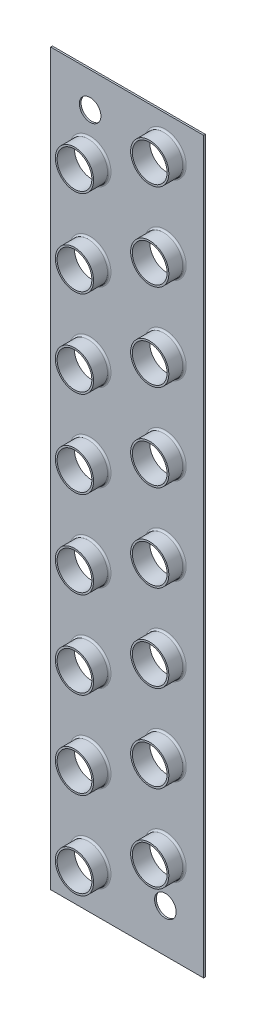
from build123d import *

# Parameters (mm, degrees)
SKETCH2_W           = 44
SKETCH2_H           = 210
BOSS_EXTRUDE1_DEPTH = 0.5
SKETCH3_R           = 5
CUT_EXTRUDE1_DEPTH  = 215.560597501
BOSS_EXTRUDE2_START = 4.5
SKETCH4_R           = 5.5
SKETCH4_R_2         = 5
BOSS_EXTRUDE2_DEPTH = 4.5
LPATTERN1_COUNT     = 8
LPATTERN1_PITCH     = 25
FILLET1_R           = 0.5
SKETCH5_R           = 3.1
CUT_EXTRUDE2_DEPTH  = 215.618265765


with BuildPart() as part:
    # Sketch2 → Boss-Extrude1 (new body)
    with BuildSketch(Plane.XY):
        with Locations((22, -105)):
            Rectangle(SKETCH2_W, SKETCH2_H)
    extrude(amount=BOSS_EXTRUDE1_DEPTH)

    # Sketch3 → Cut-Extrude1 (cut, through all)
    with BuildSketch(Plane.XY.offset(0.5)):
        with Locations((33, -10)):
            Circle(SKETCH3_R)
        with Locations((11.349364905, -22.5)):
            Circle(SKETCH3_R)
    cut_extrude1 = extrude(amount=-CUT_EXTRUDE1_DEPTH, mode=Mode.SUBTRACT)

    # Sketch4 → Boss-Extrude2 (add)
    # profile 1 of 2: a face of its own
    with BuildSketch(Plane.XY.offset(0.5).offset(BOSS_EXTRUDE2_START)):
        with Locations((11.349364905, -22.5)):
            Circle(SKETCH4_R)
        with Locations((11.349364905, -22.5)):
            Circle(SKETCH4_R_2, mode=Mode.SUBTRACT)
    # profile 2 of 2: a face of its own
    with BuildSketch(Plane.XY.offset(0.5).offset(BOSS_EXTRUDE2_START)):
        with Locations((33, -10)):
            Circle(SKETCH4_R)
        with Locations((33, -10)):
            Circle(SKETCH4_R_2, mode=Mode.SUBTRACT)
    boss_extrude2 = extrude(amount=-BOSS_EXTRUDE2_DEPTH)

    # LPattern1: Cut-Extrude1, Boss-Extrude2 ×8
    with Locations(*[(0, -i * LPATTERN1_PITCH, 0) for i in range(1, LPATTERN1_COUNT)]):
        add(cut_extrude1, mode=Mode.SUBTRACT)
        add(boss_extrude2)

    # Fillet1
    fillet1_edges = [part.edges().sort_by_distance(p)[0] for p in [
        (5.849364905, -72.5, 0.5),
        (27.5, -60, 0.5),
        (5.849364905, -97.5, 0.5),
        (27.5, -85, 0.5),
        (5.849364905, -122.5, 0.5),
        (27.5, -110, 0.5),
        (5.849364905, -147.5, 0.5),
        (27.5, -135, 0.5),
        (5.849364905, -172.5, 0.5),
        (27.5, -160, 0.5),
        (5.849364905, -197.5, 0.5),
        (27.5, -185, 0.5),
        (5.849364905, -22.5, 0.5),
        (27.5, -10, 0.5),
        (5.849364905, -47.5, 0.5),
        (27.5, -35, 0.5),
    ]]
    fillet(fillet1_edges, radius=FILLET1_R)

    # Sketch5 → Cut-Extrude2 (cut, through all)
    with BuildSketch(Plane(origin=(0, 0, 0), x_dir=(-1, 0, 0), z_dir=(0, 0, -1))):
        with Locations((-33, -197.5)):
            Circle(SKETCH5_R)
        with Locations((-11.349364905, -10)):
            Circle(SKETCH5_R)
    extrude(amount=-CUT_EXTRUDE2_DEPTH, mode=Mode.SUBTRACT)


solid = part.part
